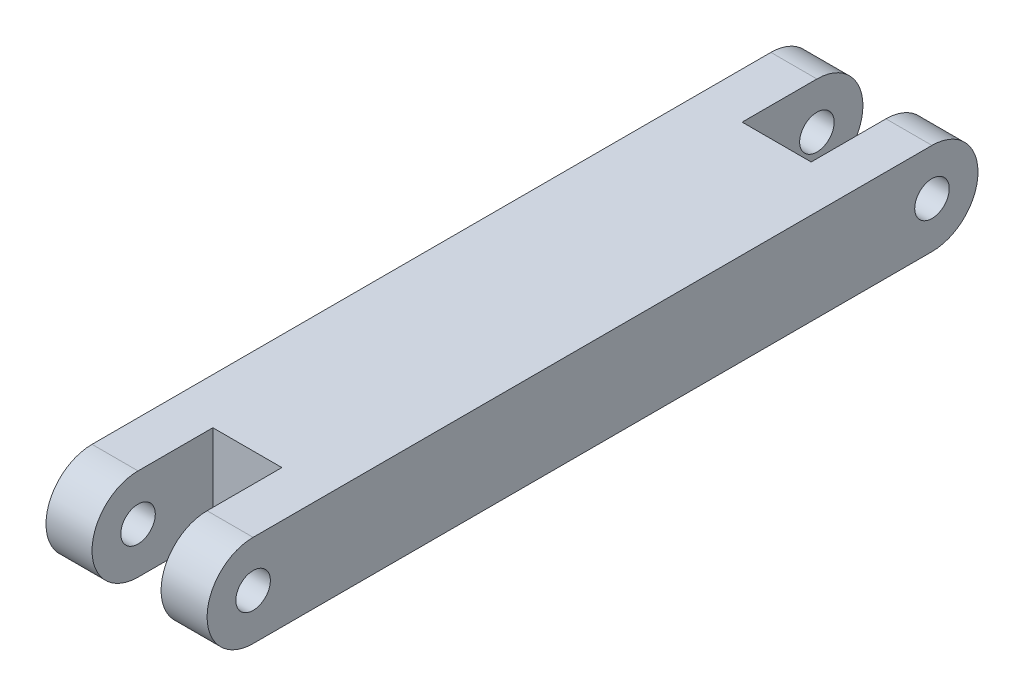
from build123d import *

# Parameters (mm, degrees)
CROQUIS1_R              = 1.5
SALIENTE_EXTRUIR1_DEPTH = 4
CROQUIS2_W              = 6
CROQUIS2_H              = 8
SALIENTE_EXTRUIR2_DEPTH = 23
CROQUIS3_R              = 1.5
SALIENTE_EXTRUIR3_DEPTH = 4


with BuildPart() as part:
    # Croquis1 → Saliente-Extruir1 (new body)
    with BuildSketch(Plane(origin=(0, 0, 0), x_dir=(0, 0, -1), z_dir=(1, 0, 0))):
        with BuildLine():
            Line((-29.5, 4), (29.5, 4))
            ThreePointArc((29.5, 4), (33.5, 0), (29.5, -4))
            Line((29.5, -4), (-29.5, -4))
            ThreePointArc((-29.5, -4), (-33.5, 0), (-29.5, 4))
        make_face()
        with Locations((-29.5, 0)):
            Circle(CROQUIS1_R, mode=Mode.SUBTRACT)
        with Locations((29.5, 0)):
            Circle(CROQUIS1_R, mode=Mode.SUBTRACT)
    extrude(amount=SALIENTE_EXTRUIR1_DEPTH)

    # Croquis2 → Saliente-Extruir2 (add, symmetric)
    with BuildSketch(Plane.XY):
        with Locations((7, 0)):
            Rectangle(CROQUIS2_W, CROQUIS2_H)
    extrude(amount=SALIENTE_EXTRUIR2_DEPTH, both=True)

    # Croquis3 → Saliente-Extruir3 (add)
    with BuildSketch(Plane(origin=(10, 0, 0), x_dir=(0, 0, -1), z_dir=(1, 0, 0))):
        with BuildLine():
            Line((-29.5, 4), (29.5, 4))
            ThreePointArc((29.5, 4), (33.5, 0), (29.5, -4))
            Line((29.5, -4), (-29.5, -4))
            ThreePointArc((-29.5, -4), (-33.5, 0), (-29.5, 4))
        make_face()
        with Locations((-29.5, 0)):
            Circle(CROQUIS3_R, mode=Mode.SUBTRACT)
        with Locations((29.5, 0)):
            Circle(CROQUIS3_R, mode=Mode.SUBTRACT)
    extrude(amount=SALIENTE_EXTRUIR3_DEPTH)


solid = part.part
